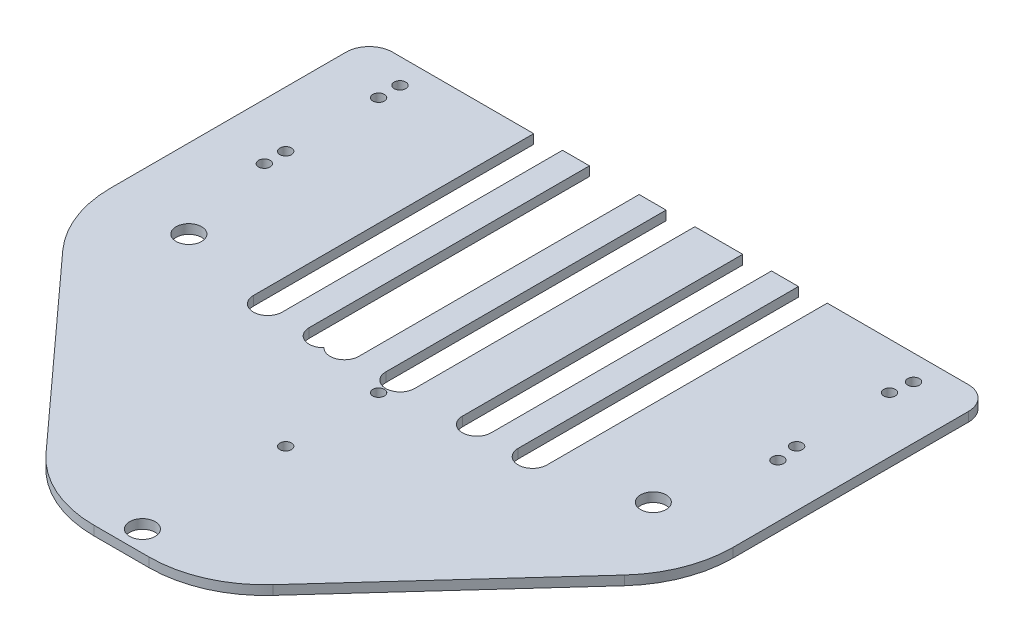
from build123d import *

# Parameters (mm, degrees)
SKETCH1_W                  = 134
SKETCH1_H                  = 120.35
BOSS_EXTRUDE1_DEPTH        = 2
CUT_EXTRUDE1_DEPTH         = 181.122520802
CUT_EXTRUDE2_DEPTH         = 181.122520802
LINEAR_BEARING_D           = 2.5
BELT_HOLDERS_D             = 2.5
CUT_EXTRUDE3_DEPTH         = 181.122520802
FILLET1_R                  = 5
FILLET2_R                  = 25
F_5_5_5_5_DIAMETER_HOLE1_D = 5.5


with BuildPart() as part:
    # Sketch1 → Boss-Extrude1 (new body)
    with BuildSketch(Plane(origin=(0, 0, 0), x_dir=(1, 0, 0), z_dir=(0, 1, 0))):
        with Locations((67, 60.175)):
            Rectangle(SKETCH1_W, SKETCH1_H)
    extrude(amount=BOSS_EXTRUDE1_DEPTH)

    # Sketch3 → Cut-Extrude1 (cut, through all)
    with BuildSketch(Plane(origin=(0, 2, 0), x_dir=(1, 0, 0), z_dir=(0, 1, 0))):
        with BuildLine():
            Line((86.6, 120.35), (86.6, 60))
            ThreePointArc((86.6, 60), (83.5, 56.9), (80.4, 60))
            Line((80.4, 60), (80.4, 120.35))
            Line((80.4, 120.35), (86.6, 120.35))
        make_face()
        with BuildLine():
            Line((70.1, 120.35), (70.1, 60))
            ThreePointArc((70.1, 60), (67, 56.9), (63.9, 60))
            Line((63.9, 60), (63.9, 120.35))
            Line((63.9, 120.35), (70.1, 120.35))
        make_face()
        with BuildLine():
            Line((98.6, 120.35), (98.6, 60))
            ThreePointArc((98.6, 60), (95.5, 56.9), (92.4, 60))
            Line((92.4, 60), (92.4, 120.35))
            Line((92.4, 120.35), (98.6, 120.35))
        make_face()
        with BuildLine():
            Line((58.1, 120.35), (58.1, 60))
            ThreePointArc((58.1, 60), (55, 56.9), (51.9, 60))
            Line((51.9, 60), (51.9, 120.35))
            Line((51.9, 120.35), (58.1, 120.35))
        make_face()
        with BuildLine():
            Line((41.6, 120.35), (41.6, 60))
            ThreePointArc((41.6, 60), (38.5, 56.9), (35.4, 60))
            Line((35.4, 60), (35.4, 120.35))
            Line((35.4, 120.35), (41.6, 120.35))
        make_face()
    extrude(amount=-CUT_EXTRUDE1_DEPTH, mode=Mode.SUBTRACT)

    # Sketch4 → Cut-Extrude2 (cut, through all)
    with BuildSketch(Plane(origin=(0, 2, 0), x_dir=(1, 0, 0), z_dir=(0, 1, 0))):
        with BuildLine():
            Line((47.4, 120.35), (53.6, 120.35))
            Line((53.6, 120.35), (53.6, 60))
            ThreePointArc((53.6, 60), (50.5, 56.9), (47.4, 60))
            Line((47.4, 60), (47.4, 120.35))
        make_face()
    extrude(amount=-CUT_EXTRUDE2_DEPTH, mode=Mode.SUBTRACT)

    # linear bearing (through all)
    with Locations(Plane(origin=(0, 2, 0), x_dir=(1, 0, 0), z_dir=(0, 1, 0))):
        with Locations((12, 110.35), (12, 90.35), (122, 110.35), (122, 90.35), (67, 55.35), (67, 35.35)):
            Hole(LINEAR_BEARING_D / 2)

    # belt holders (through all)
    with Locations(Plane(origin=(0, 2, 0), x_dir=(1, 0, 0), z_dir=(0, 1, 0))):
        with Locations((12, 114.95), (12, 85.75), (122.58126033, 85.75), (122.58126033, 114.95)):
            Hole(BELT_HOLDERS_D / 2)

    # Sketch9 → Cut-Extrude3 (cut, through all)
    with BuildSketch(Plane(origin=(0, 2, 0), x_dir=(1, 0, 0), z_dir=(0, 1, 0))):
        Polygon((0, 55), (50, 0), (0, 0), align=None)
        Polygon((134, 0), (134, 55), (84, 0), align=None)
    extrude(amount=-CUT_EXTRUDE3_DEPTH, mode=Mode.SUBTRACT)

    # Fillet1
    fillet1_edges = [part.edges().sort_by_distance(p)[0] for p in [
        (0, 1, -120.35),
        (134, 1, -120.35),
    ]]
    fillet(fillet1_edges, radius=FILLET1_R)

    # Fillet2
    fillet2_edges = [part.edges().sort_by_distance(p)[0] for p in [
        (0, 1, -55),
        (50, 1, 0),
        (84, 1, 0),
        (134, 1, -55),
    ]]
    fillet(fillet2_edges, radius=FILLET2_R)

    # Ø5.5 (5.5) Diameter Hole1 (through all)
    with Locations(Plane(origin=(0, 2, 0), x_dir=(1, 0, 0), z_dir=(0, 1, 0))):
        with Locations((67, 4.5), (117, 64.5), (17, 64.5)):
            Hole(F_5_5_5_5_DIAMETER_HOLE1_D / 2)


solid = part.part
